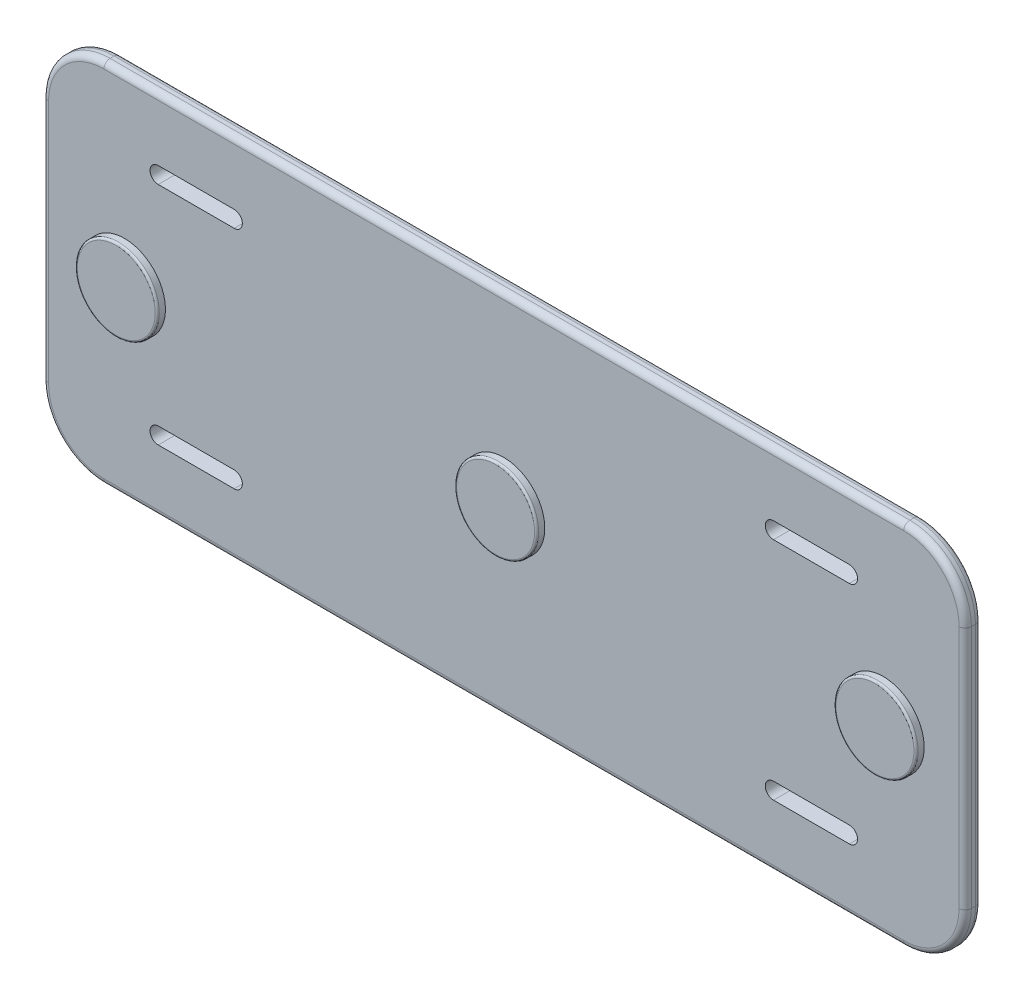
from build123d import *

# Parameters (mm, degrees)
BOSS_EXTRUDE1_DEPTH = 4
SKETCH2_R           = 20
BOSS_EXTRUDE2_DEPTH = 4
SKETCH3_R           = 20
BOSS_EXTRUDE3_DEPTH = 4
CUT_EXTRUDE2_DEPTH  = 8
FILLET1_R           = 3
FILLET2_R           = 1


with BuildPart() as part:
    # Sketch1 → Boss-Extrude1 (new, symmetric)
    with BuildSketch(Plane.XY):
        with BuildLine():
            Line((195, 89.5), (-195, 89.5))
            ThreePointArc((-195, 89.5), (-216.213203436, 80.713203436), (-225, 59.5))
            Line((-225, 59.5), (-225, -59.5))
            ThreePointArc((-225, -59.5), (-216.213203436, -80.713203436), (-195, -89.5))
            Line((-195, -89.5), (195, -89.5))
            ThreePointArc((195, -89.5), (216.213203436, -80.713203436), (225, -59.5))
            Line((225, -59.5), (225, 59.5))
            ThreePointArc((225, 59.5), (216.213203436, 80.713203436), (195, 89.5))
        make_face()
    extrude(amount=BOSS_EXTRUDE1_DEPTH, both=True)

    # Sketch2 → Boss-Extrude2 (add, symmetric)
    with BuildSketch(Plane.XY.offset(4)):
        with Locations(Location((-185, 0, 0), (0, 0, 180))):
            Circle(SKETCH2_R)
        with Locations(Location((185, 0, 0), (0, 0, 180))):
            Circle(SKETCH2_R)
    extrude(amount=BOSS_EXTRUDE2_DEPTH, both=True)

    # Sketch3 → Boss-Extrude3 (add, symmetric)
    with BuildSketch(Plane.XY.offset(4)):
        with Locations(Location((0, 0, 0), (0, 0, 180))):
            Circle(SKETCH3_R)
    extrude(amount=BOSS_EXTRUDE3_DEPTH, both=True)

    # Sketch4 → Cut-Extrude2 (cut)
    with BuildSketch(Plane.XY.offset(4)):
        with BuildLine():
            Line((-168.5, 59), (-131.5, 59))
            ThreePointArc((-131.5, 59), (-127.5, 55), (-131.5, 51))
            Line((-131.5, 51), (-168.5, 51))
            ThreePointArc((-168.5, 51), (-172.5, 55), (-168.5, 59))
        make_face()
        with BuildLine():
            Line((168.5, 59), (131.5, 59))
            ThreePointArc((131.5, 59), (127.5, 55), (131.5, 51))
            Line((131.5, 51), (168.5, 51))
            ThreePointArc((168.5, 51), (172.5, 55), (168.5, 59))
        make_face()
        with BuildLine():
            Line((-168.5, -59), (-131.5, -59))
            ThreePointArc((-131.5, -59), (-127.5, -55), (-131.5, -51))
            Line((-131.5, -51), (-168.5, -51))
            ThreePointArc((-168.5, -51), (-172.5, -55), (-168.5, -59))
        make_face()
        with BuildLine():
            Line((168.5, -59), (131.5, -59))
            ThreePointArc((131.5, -59), (127.5, -55), (131.5, -51))
            Line((131.5, -51), (168.5, -51))
            ThreePointArc((168.5, -51), (172.5, -55), (168.5, -59))
        make_face()
    extrude(amount=-CUT_EXTRUDE2_DEPTH, mode=Mode.SUBTRACT)

    # Fillet1
    fillet1_edges = [part.edges().sort_by_distance(p)[0] for p in [
        (225, 0, -4),
        (216.213203436, -80.713203436, -4),
        (0, -89.5, -4),
        (-216.213203436, -80.713203436, -4),
        (216.213203436, -80.713203436, 4),
        (225, 0, 4),
        (216.213203436, 80.713203436, 4),
        (0, 89.5, 4),
        (-216.213203436, 80.713203436, 4),
        (-225, 0, 4),
        (-216.213203436, -80.713203436, 4),
        (-225, 0, -4),
        (0, -89.5, 4),
        (-216.213203436, 80.713203436, -4),
        (0, 89.5, -4),
        (216.213203436, 80.713203436, -4),
    ]]
    fillet(fillet1_edges, radius=FILLET1_R)

    # Fillet2
    fillet2_edges = [part.edges().sort_by_distance(p)[0] for p in [
        (205, 0, 8),
        (-165, 0, 8),
        (20, 0, 8),
    ]]
    fillet(fillet2_edges, radius=FILLET2_R)


solid = part.part
